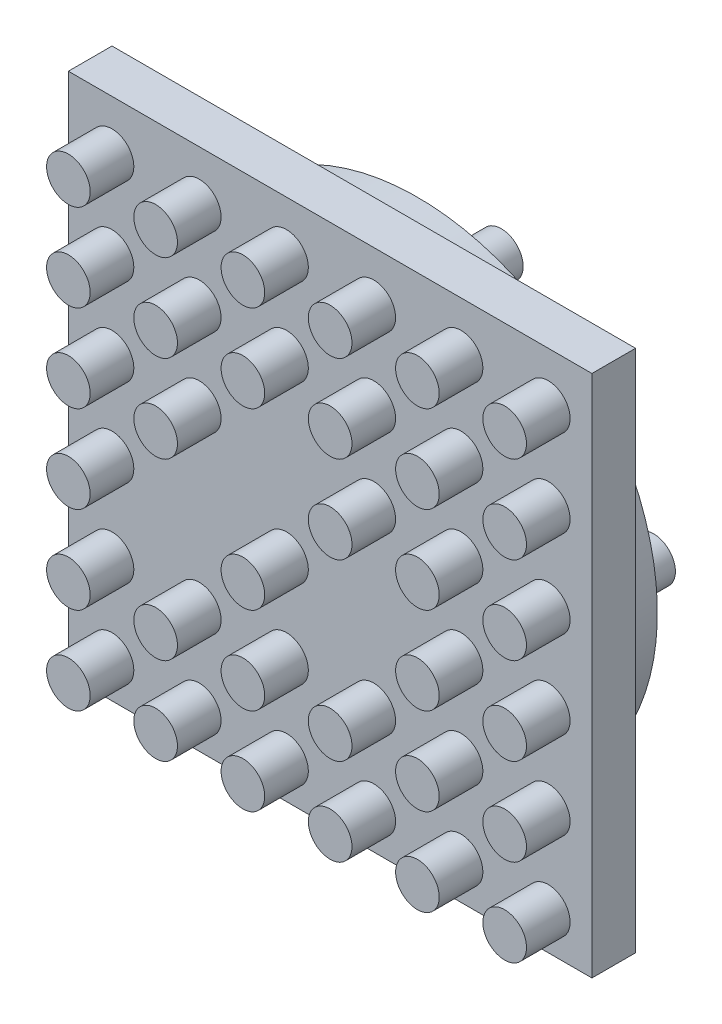
from build123d import *

# Parameters (mm, degrees)
SKETCH1_W             = 120
SKETCH1_H             = 120
SKETCH1_R             = 5
BOSS_EXTRUDE1_DEPTH   = 10
SKETCH1_3_R           = 5
BOSS_EXTRUDE2_DEPTH   = 10
LPATTERN2_COUNT       = 6
LPATTERN2_PITCH       = 20
LPATTERN2_COUNT_DIR2  = 9
LPATTERN2_PITCH_DIR2  = 20
SKETCH3_R             = 55
SKETCH3_R_2           = 5
BOSS_EXTRUDE3_DEPTH   = 10
SKETCH3_3_R           = 5
BOSS_EXTRUDE4_DEPTH   = 21
BOSS_EXTRUDE4_2_DEPTH = 21
CIRPATTERN1_COUNT     = 9


with BuildPart() as part:
    # Sketch1 → Boss-Extrude1 (new body)
    # profile 1 of 2: a face of its own
    with BuildSketch(Plane.XY):
        with Locations((0, 60)):
            Rectangle(SKETCH1_W, SKETCH1_H)
        with Locations((-50, 108.555236637)):
            Circle(SKETCH1_R, mode=Mode.SUBTRACT)
    # profile 2 of 2: a face of its own
    with BuildSketch(Plane.XY):
        with Locations((-50, 108.555236637)):
            Circle(SKETCH1_R)
    extrude(amount=-BOSS_EXTRUDE1_DEPTH)

    # Sketch1<3> → Boss-Extrude2 (add)
    with BuildSketch(Plane.XY):
        with Locations((-50, 108.555236637)):
            Circle(SKETCH1_3_R)
    boss_extrude2 = extrude(amount=BOSS_EXTRUDE2_DEPTH)

    # LPattern2: Boss-Extrude2 6 × 9, 21 skipped
    with Locations(*[(i * LPATTERN2_PITCH, -j * LPATTERN2_PITCH_DIR2, 0) for i in range(LPATTERN2_COUNT) for j in range(LPATTERN2_COUNT_DIR2) if (i, j) not in ((0, 0), (0, 6), (0, 7), (0, 8), (1, 3), (1, 6), (1, 7), (1, 8), (2, 2), (2, 6), (2, 7), (2, 8), (3, 3), (3, 6), (3, 7), (3, 8), (4, 6), (4, 7), (4, 8), (5, 6), (5, 7), (5, 8))]):
        add(boss_extrude2)

    # Sketch3 → Boss-Extrude3 (add)
    # profile 1 of 3: a face of its own
    with BuildSketch(Plane(origin=(0, 0, -10), x_dir=(-1, 0, 0), z_dir=(0, 0, -1))):
        with Locations((0, 60)):
            Circle(SKETCH3_R)
        with Locations((20.9185191, 97.737008456)):
            Circle(SKETCH3_R_2, mode=Mode.SUBTRACT)
        with Locations((0, 60)):
            Circle(SKETCH3_R_2, mode=Mode.SUBTRACT)
    # profile 2 of 3: a face of its own
    with BuildSketch(Plane(origin=(0, 0, -10), x_dir=(-1, 0, 0), z_dir=(0, 0, -1))):
        with Locations((20.9185191, 97.737008456)):
            Circle(SKETCH3_R_2)
    # profile 3 of 3: a face of its own
    with BuildSketch(Plane(origin=(0, 0, -10), x_dir=(-1, 0, 0), z_dir=(0, 0, -1))):
        with Locations((0, 60)):
            Circle(SKETCH3_R_2)
    extrude(amount=BOSS_EXTRUDE3_DEPTH)


with BuildPart() as body_2:
    # Sketch3<3> → Boss-Extrude4 (new body)
    with BuildSketch(Plane(origin=(0, 0, -10), x_dir=(-1, 0, 0), z_dir=(0, 0, -1))):
        with Locations((20.9185191, 97.737008456)):
            Circle(SKETCH3_3_R)
    boss_extrude4 = extrude(amount=BOSS_EXTRUDE4_DEPTH)


with BuildPart() as body_3:
    # Sketch3<3> → Boss-Extrude4 2 (new body)
    with BuildSketch(Plane(origin=(0, 0, -10), x_dir=(-1, 0, 0), z_dir=(0, 0, -1))):
        with Locations((0, 60)):
            Circle(SKETCH3_3_R)
    boss_extrude4_2 = extrude(amount=BOSS_EXTRUDE4_2_DEPTH)


with BuildPart() as part_1:
    add(part.part)

    # CirPattern1: Boss-Extrude4, Boss-Extrude4 2 ×9 about axis
    cirpattern1_axis = Axis((0, 60, 0), (0, 0, 1))
    add([boss_extrude4.rotate(cirpattern1_axis, i * 360 / CIRPATTERN1_COUNT) for i in range(1, CIRPATTERN1_COUNT)])
    add([boss_extrude4_2.rotate(cirpattern1_axis, i * 360 / CIRPATTERN1_COUNT) for i in range(1, CIRPATTERN1_COUNT)])


solid = Compound([body_2.part, body_3.part, part_1.part])
